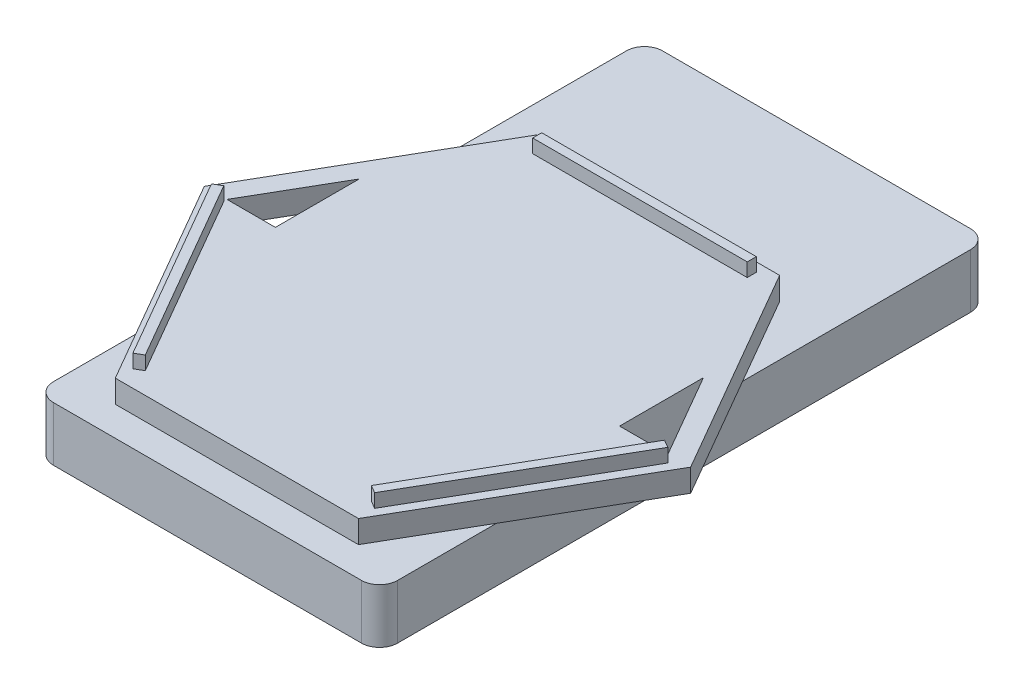
from build123d import *

# Parameters (mm, degrees)
RESSALTO_EXTRUS_O1_DEPTH = 3
ESBO_O2_W                = 47.384173958
ESBO_O2_H                = 2
RESSALTO_EXTRUS_O2_DEPTH = 3
RESSALTO_EXTRUS_O3_DEPTH = 2
RESSALTO_EXTRUS_O5_DEPTH = 12
CORTE_EXTRUS_O1_DEPTH    = 131
CORTE_EXTRUS_O3_DEPTH    = 10


with BuildPart() as part:
    # Esboço1 → Ressalto-extrusão1 (new body)
    with BuildSketch(Plane(origin=(0, 0, 0), x_dir=(1, 0, 0), z_dir=(0, 1, 0))):
        Polygon((53.693575035, 0), (26.846787517, 46.5), (-26.846787517, 46.5), (-53.693575035, 0), (-26.846787517, -46.5), (26.846787517, -46.5), align=None)
    extrude(amount=RESSALTO_EXTRUS_O1_DEPTH)

    # Esboço2 → Ressalto-extrusão2 (add)
    with BuildSketch(Plane(origin=(0, 3, 0), x_dir=(1, 0, 0), z_dir=(0, 1, 0))):
        with Locations((0, 43.5)):
            Rectangle(ESBO_O2_W, ESBO_O2_H)
        Polygon((-50.384173958, -1.732050808), (-26.692086979, -42.767949192), (-24.960036171, -41.767949192), (-48.65212315, -0.732050808), align=None)
        Polygon((26.692086979, -42.767949192), (50.384173958, -1.732050808), (48.65212315, -0.732050808), (24.960036171, -41.767949192), align=None)
    extrude(amount=RESSALTO_EXTRUS_O2_DEPTH)

    # Esboço3 → Ressalto-extrusão3 (add)
    with BuildSketch(Plane.XZ):
        Polygon((26.846787517, 46.5), (-26.846787517, 46.5), (-53.693575035, 0), (-26.846787517, -46.5), (26.846787517, -46.5), (53.693575035, 0), align=None)
    extrude(amount=RESSALTO_EXTRUS_O3_DEPTH)

    # Esboço5 → Ressalto-extrusão5 (add)
    with BuildSketch(Plane.XZ.offset(2)):
        with BuildLine():
            Line((38, 49.00146682), (38, -77.5))
            ThreePointArc((38, -77.5), (36.828427125, -80.328427125), (34, -81.5))
            Line((34, -81.5), (-34, -81.5))
            ThreePointArc((-34, -81.5), (-36.828427125, -80.328427125), (-38, -77.5))
            Line((-38, -77.5), (-38, 49.00146682))
            ThreePointArc((-38, 49.00146682), (-36.828427125, 51.829893945), (-34, 53.00146682))
            Line((-34, 53.00146682), (34, 53.00146682))
            ThreePointArc((34, 53.00146682), (36.828427125, 51.829893945), (38, 49.00146682))
        make_face()
    extrude(amount=RESSALTO_EXTRUS_O5_DEPTH)

    # Esboço7 → Corte-extrusão1 (cut)
    with BuildSketch(Plane(origin=(0, 0, -81.5), x_dir=(-1, 0, 0), z_dir=(0, 0, -1))):
        Polygon((-34.2, -3), (34.2, -3), (34.2, -12.3), (31.2, -12.3), (31.2, -23.281359025), (-31.2, -26.250413902), (-31.2, -12.3), (-34.2, -12.3), align=None)
    extrude(amount=-CORTE_EXTRUS_O1_DEPTH, mode=Mode.SUBTRACT)

    # Esboço8 → Corte-extrusão3 (cut)
    with BuildSketch(Plane.XZ.offset(2)):
        Polygon((-48.693575035, 0), (-38, 0), (-38, -18.521815275), align=None)
        Polygon((38, 0), (48.693575035, 0), (38, -18.521815275), align=None)
    extrude(amount=-CORTE_EXTRUS_O3_DEPTH, mode=Mode.SUBTRACT)


solid = part.part
